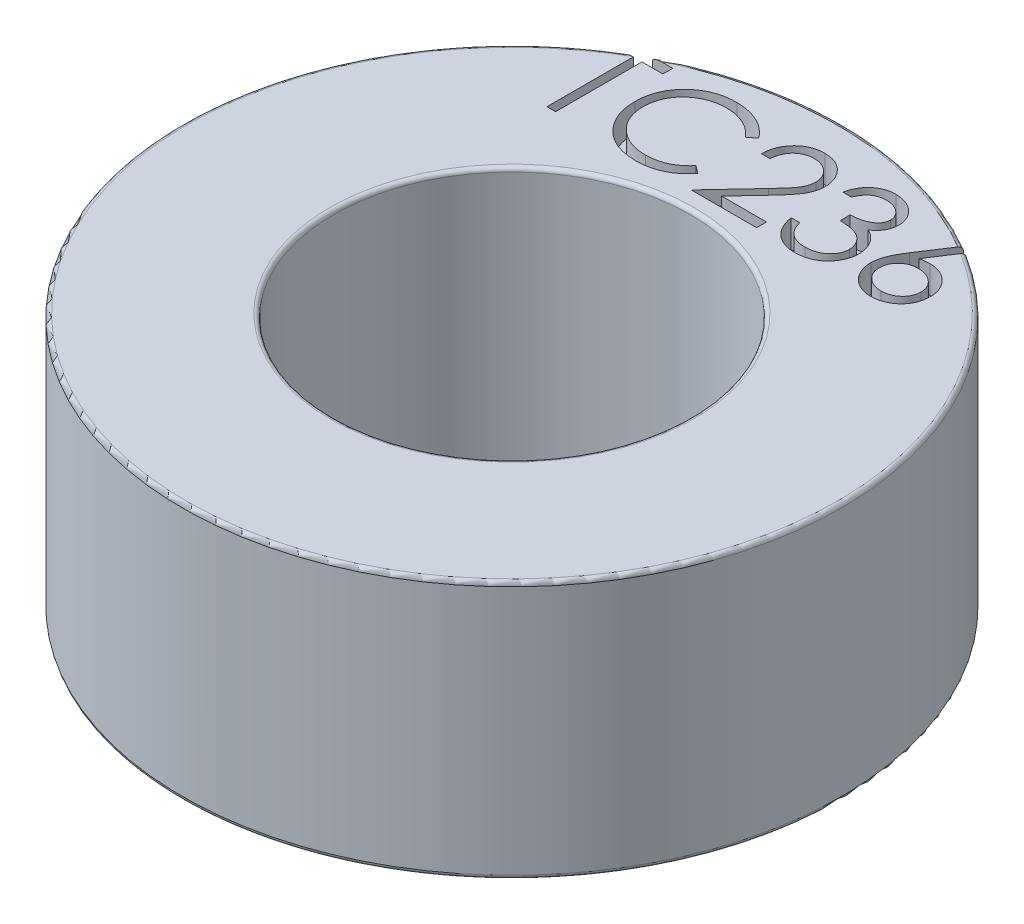
from build123d import *

# Parameters (mm, degrees)
CUT_EXTRUDE1_DEPTH = 1


with BuildPart() as part:
    # Toroidal Core TC236 → Revolve2 (revolve)
    with BuildSketch(Plane.XY, mode=Mode.PRIVATE) as revolve2_sk:
        with BuildLine():
            Line((6.646058459, 0), (11.853941541, 0))
            ThreePointArc((11.853941541, 0), (11.957220468, 0.042779532), (12, 0.146058459))
            Line((12, 0.146058459), (12, 9.243941541))
            ThreePointArc((12, 9.243941541), (11.957220468, 9.347220468), (11.853941541, 9.39))
            Line((11.853941541, 9.39), (6.646058459, 9.39))
            ThreePointArc((6.646058459, 9.39), (6.542779532, 9.347220468), (6.5, 9.243941541))
            Line((6.5, 9.243941541), (6.5, 0.146058459))
            ThreePointArc((6.5, 0.146058459), (6.542779532, 0.042779532), (6.646058459, 0))
        make_face()
    revolve(revolve2_sk.sketch.rotate(Axis((0, -8.107972275, 0), (0, 1, 0)), 90), axis=Axis((0, -8.107972275, 0), (0, 1, 0)))

    # Sketch1 → Cut-Extrude1 (cut)
    # profile 1 of 5: a face of its own
    with BuildSketch(Plane(origin=(0, 9.39, 0), x_dir=(1, 0, 0), z_dir=(0, 1, 0))):
        Polygon((-6.631969117, 10.288046022), (-6.631969117, 10.647020381), (-4.792225527, 10.647020381), (-4.792225527, 10.288046022), (-5.55504604, 10.288046022), (-5.55504604, 7.147020381), (-5.869148604, 7.147020381), (-5.869148604, 10.288046022), align=None)
    # profile 2 of 5: a face of its own
    with BuildSketch(Plane(origin=(0, 9.39, 0), x_dir=(1, 0, 0), z_dir=(0, 1, 0))):
        with BuildLine():
            Line((-1.022994758, 10.004792817), (-1.297834502, 9.794456278))
            add(Edge.make_bspline(
                [(-1.297834502, 9.794456278), (-1.31744039, 9.817822248), (-1.356387837, 9.864239164), (-1.419047039, 9.929418708), (-1.484348682, 9.99048397), (-1.552267803, 10.04772585), (-1.624026923, 10.099142615), (-1.697887721, 10.147413718), (-1.775085767, 10.190681456), (-1.881837501, 10.243144442), (-2.02148535, 10.297890597), (-2.197280189, 10.343793829), (-2.380791287, 10.373015004), (-2.505988887, 10.376179846), (-2.569669437, 10.377789612)],
                knots=[0, 0, 0, 0, 0.757959112, 1.505699292, 2.245454638, 2.979532153, 3.711538275, 4.438200793, 5.171680507, 5.909471876, 7.393775596, 8.890124382, 10.418191784, 12, 12, 12, 12], degree=3))
            add(Edge.make_bspline(
                [(-2.569669437, 10.377789612), (-2.604752737, 10.377385649), (-2.674593729, 10.376581473), (-2.778242203, 10.365972348), (-2.879955254, 10.351061138), (-2.97966672, 10.328935815), (-3.077249679, 10.300963196), (-3.173342081, 10.267537782), (-3.266552681, 10.226182942), (-3.358170919, 10.180474682), (-3.44595013, 10.128847237), (-3.529005178, 10.072533885), (-3.607033145, 10.012164789), (-3.680095758, 9.947513683), (-3.748267706, 9.878871722), (-3.811055017, 9.805507381), (-3.868240427, 9.727655207), (-3.920957452, 9.6463418), (-3.968170185, 9.561804008), (-4.007700065, 9.473728937), (-4.042705187, 9.383624834), (-4.07040443, 9.290473674), (-4.092328947, 9.194930908), (-4.10745661, 9.09674012), (-4.117945081, 8.99610644), (-4.118745258, 8.927897128), (-4.119148604, 8.893514772)],
                knots=[0, 0, 0, 0, 1.054917814, 2.100044995, 3.131103042, 4.146048494, 5.169673617, 6.183595914, 7.203665975, 8.234915748, 9.262203917, 10.264457458, 11.251630812, 12.227803204, 13.197192746, 14.159520551, 15.12972552, 16.100847026, 17.073214652, 18.039054194, 19.002613845, 19.979014051, 20.95965708, 21.949030935, 22.966165397, 24, 24, 24, 24], degree=3))
            add(Edge.make_bspline(
                [(-4.119148604, 8.893514772), (-4.117886785, 8.841783452), (-4.115409371, 8.740215867), (-4.093361037, 8.591445257), (-4.059855945, 8.448924583), (-4.009640368, 8.313544741), (-3.947721318, 8.183636383), (-3.869480706, 8.061397529), (-3.778864169, 7.944980965), (-3.67458975, 7.837138017), (-3.560183934, 7.738624292), (-3.437436022, 7.65187371), (-3.306651734, 7.579558828), (-3.169275104, 7.519382881), (-3.02424899, 7.473126153), (-2.871834188, 7.44056203), (-2.712362192, 7.419319849), (-2.603392793, 7.417286161), (-2.547934662, 7.41625115)],
                knots=[0, 0, 0, 0, 1.029171465, 2.020641659, 2.987623507, 3.938342917, 4.889210282, 5.84687017, 6.821220943, 7.821438502, 8.827599549, 9.822697543, 10.807740252, 11.797342354, 12.80366471, 13.83203677, 14.896651826, 16, 16, 16, 16], degree=3))
            add(Edge.make_bspline(
                [(-2.547934662, 7.41625115), (-2.486831973, 7.41793993), (-2.366567264, 7.421263853), (-2.190199238, 7.449423102), (-2.021363472, 7.495081019), (-1.860050885, 7.558978942), (-1.706716239, 7.64204423), (-1.561119579, 7.742742107), (-1.423138008, 7.86203044), (-1.340166726, 7.953113568), (-1.297834502, 7.999584484)],
                knots=[0, 0, 0, 0, 1.028121516, 2.023589091, 2.998037872, 3.967518031, 4.937445131, 5.927275754, 6.942489185, 8, 8, 8, 8], degree=3))
            Line((-1.297834502, 7.999584484), (-1.022994758, 7.791351311))
            add(Edge.make_bspline(
                [(-1.022994758, 7.791351311), (-1.045112868, 7.762812859), (-1.089243143, 7.705872652), (-1.16070116, 7.625600943), (-1.235978457, 7.550096907), (-1.315634167, 7.479969286), (-1.398751959, 7.41381482), (-1.486824271, 7.353512989), (-1.578693304, 7.298222105), (-1.674047783, 7.24759518), (-1.772786396, 7.202677933), (-1.874790831, 7.164224165), (-1.979621406, 7.131099276), (-2.087282914, 7.103847339), (-2.197998671, 7.082576255), (-2.311369145, 7.06835658), (-2.427639021, 7.058614666), (-2.506080442, 7.05772675), (-2.545831296, 7.057276791)],
                knots=[0, 0, 0, 0, 0.986787822, 1.968848986, 2.935600012, 3.899624008, 4.868462664, 5.837806735, 6.815139263, 7.798259679, 8.787526145, 9.778297419, 10.776456485, 11.791383307, 12.812564526, 13.85620153, 14.913611965, 16, 16, 16, 16], degree=3))
            add(Edge.make_bspline(
                [(-2.545831296, 7.057276791), (-2.583474963, 7.057538784), (-2.657910654, 7.058056842), (-2.767809405, 7.066449009), (-2.874798986, 7.077898746), (-2.978573612, 7.095138877), (-3.079699587, 7.115483217), (-3.177260171, 7.142754474), (-3.272215382, 7.17330364), (-3.364183722, 7.209208627), (-3.453243422, 7.24972481), (-3.539107234, 7.295516369), (-3.621735666, 7.346198233), (-3.701941087, 7.400653244), (-3.778538671, 7.460630545), (-3.852192196, 7.52529718), (-3.923314672, 7.594435191), (-3.967317357, 7.644290044), (-3.989441072, 7.669356118)],
                knots=[0, 0, 0, 0, 1.114604814, 2.203992996, 3.262667896, 4.300477797, 5.318619304, 6.316056647, 7.298880507, 8.271930387, 9.238335007, 10.195173496, 11.151986948, 12.108099108, 13.064862484, 14.031167946, 15.010108607, 16, 16, 16, 16], degree=3))
            add(Edge.make_bspline(
                [(-3.989441072, 7.669356118), (-4.024876716, 7.712897307), (-4.095320192, 7.799454018), (-4.185445876, 7.939739999), (-4.262593431, 8.086208208), (-4.324969352, 8.239628136), (-4.373732085, 8.399655524), (-4.40751328, 8.566371038), (-4.429464885, 8.73961898), (-4.431975173, 8.857455769), (-4.433251168, 8.917352913)],
                knots=[0, 0, 0, 0, 0.994628077, 1.977248131, 2.950237994, 3.925870899, 4.908910175, 5.911660606, 6.938484602, 8, 8, 8, 8], degree=3))
            add(Edge.make_bspline(
                [(-4.433251168, 8.917352913), (-4.431695975, 8.980308367), (-4.428636228, 9.104169291), (-4.402640433, 9.285943244), (-4.360821637, 9.460094643), (-4.301424748, 9.626298388), (-4.226119397, 9.785428668), (-4.133092783, 9.936269873), (-4.023425641, 10.079786673), (-3.897978073, 10.213801424), (-3.760410738, 10.336340777), (-3.613091924, 10.44414698), (-3.456309977, 10.533864496), (-3.291792125, 10.608860659), (-3.118306444, 10.666505122), (-2.936223075, 10.706858309), (-2.74588416, 10.731975425), (-2.616021734, 10.735150633), (-2.550038027, 10.736763971)],
                knots=[0, 0, 0, 0, 1.032925535, 2.032216505, 3.007276963, 3.968222605, 4.92396291, 5.891752235, 6.871517503, 7.883894988, 8.900124299, 9.891468569, 10.874487609, 11.85992873, 12.854644235, 13.869047385, 14.917252991, 16, 16, 16, 16], degree=3))
            add(Edge.make_bspline(
                [(-2.550038027, 10.736763971), (-2.509823555, 10.736281833), (-2.430223058, 10.735327489), (-2.312470406, 10.726021346), (-2.197828079, 10.71050774), (-2.086217097, 10.68939167), (-1.97709448, 10.663184349), (-1.871294239, 10.629044051), (-1.768195553, 10.590007519), (-1.668448644, 10.545049053), (-1.572532094, 10.494582312), (-1.480475776, 10.439166688), (-1.393010917, 10.378870883), (-1.309522069, 10.314207708), (-1.231405858, 10.243809148), (-1.156444379, 10.169611552), (-1.087183301, 10.089477728), (-1.044430106, 10.033072794), (-1.022994758, 10.004792817)],
                knots=[0, 0, 0, 0, 1.096760587, 2.17092713, 3.219439832, 4.250915756, 5.268269357, 6.278326846, 7.281116186, 8.274029601, 9.260640565, 10.235837813, 11.203064059, 12.156899882, 13.114053108, 14.069676657, 15.032185724, 16, 16, 16, 16], degree=3))
        make_face()
    # profile 3 of 5: a face of its own
    with BuildSketch(Plane(origin=(0, 9.39, 0), x_dir=(1, 0, 0), z_dir=(0, 1, 0))):
        with BuildLine():
            Line((-0.170430655, 9.570097304), (-0.484533219, 9.570097304))
            add(Edge.make_bspline(
                [(-0.484533219, 9.570097304), (-0.482486066, 9.611768192), (-0.478465512, 9.693608706), (-0.459637223, 9.812932613), (-0.432696346, 9.926987412), (-0.394604892, 10.034857326), (-0.347298614, 10.137496133), (-0.290568587, 10.234496148), (-0.223374736, 10.325487337), (-0.147168002, 10.40962618), (-0.064399363, 10.486813751), (0.024906576, 10.553468994), (0.118751604, 10.609786665), (0.216851003, 10.656867907), (0.320311566, 10.692207753), (0.428194424, 10.718429393), (0.54097356, 10.734205739), (0.617813582, 10.735901524), (0.656893063, 10.736763971)],
                knots=[0, 0, 0, 0, 1.10065271, 2.161652631, 3.183658789, 4.190468796, 5.17591951, 6.163126047, 7.15150782, 8.156236427, 9.156009102, 10.134482811, 11.092018607, 12.041330605, 13.001268258, 13.972401359, 14.968799086, 16, 16, 16, 16], degree=3))
            add(Edge.make_bspline(
                [(0.656893063, 10.736763971), (0.695271137, 10.735865514), (0.770682681, 10.734100079), (0.880744696, 10.71893905), (0.98552199, 10.695193459), (1.084809757, 10.661878042), (1.177815821, 10.617093615), (1.265238866, 10.563296076), (1.348119677, 10.501076245), (1.42272646, 10.427822431), (1.49123454, 10.349620047), (1.550336795, 10.266132143), (1.600949958, 10.179902858), (1.643137638, 10.090274656), (1.674193777, 9.996403628), (1.697771985, 9.899656425), (1.711099399, 9.799031614), (1.713144822, 9.730925058), (1.714184729, 9.696299227)],
                knots=[0, 0, 0, 0, 1.111607364, 2.184268762, 3.212621178, 4.221274766, 5.211760367, 6.196651075, 7.1921475, 8.207485113, 9.220403448, 10.201281604, 11.166441695, 12.114753415, 13.065576456, 14.026450734, 14.996634279, 16, 16, 16, 16], degree=3))
            add(Edge.make_bspline(
                [(1.714184729, 9.696299227), (1.712491466, 9.647551393), (1.709134655, 9.550911179), (1.680420278, 9.408896316), (1.635573767, 9.271302897), (1.581576411, 9.160565595), (1.527103966, 9.071332101), (1.478016459, 8.997863396), (1.420551648, 8.918757928), (1.35387315, 8.834280591), (1.279360278, 8.743769685), (1.196338114, 8.64727989), (1.104214632, 8.54580812), (1.039556132, 8.476502519), (1.006051716, 8.440590093)],
                knots=[0, 0, 0, 0, 1.184426356, 2.348067706, 3.509069118, 4.696110526, 5.333549288, 6.050745305, 6.844228056, 7.710549037, 8.667450064, 9.695053472, 10.805634456, 12, 12, 12, 12], degree=3))
            Line((1.006051716, 8.440590093), (0.130350595, 7.50599474))
            Line((0.130350595, 7.50599474), (1.759056524, 7.50599474))
            Line((1.759056524, 7.50599474), (1.759056524, 7.147020381))
            Line((1.759056524, 7.147020381), (-0.619148604, 7.147020381))
            Line((-0.619148604, 7.147020381), (0.738223191, 8.595538009))
            add(Edge.make_bspline(
                [(0.738223191, 8.595538009), (0.771271078, 8.630036316), (0.834749305, 8.696300502), (0.924531882, 8.793043463), (1.00517087, 8.882793003), (1.077188263, 8.965379552), (1.139021768, 9.04201112), (1.193894, 9.110205823), (1.237859591, 9.172960273), (1.285574987, 9.245700887), (1.331788968, 9.334513204), (1.371501324, 9.443046894), (1.395716172, 9.554774146), (1.398621008, 9.630276183), (1.400082165, 9.668254355)],
                knots=[0, 0, 0, 0, 1.329631726, 2.553950428, 3.673215718, 4.687767853, 5.603093632, 6.413772471, 7.123043292, 7.734684054, 8.834405432, 9.900288307, 10.943827018, 12, 12, 12, 12], degree=3))
            add(Edge.make_bspline(
                [(1.400082165, 9.668254355), (1.399446423, 9.692135754), (1.398193497, 9.739201404), (1.387135799, 9.808207163), (1.370425293, 9.874771977), (1.346480035, 9.939100596), (1.314873295, 10.000546248), (1.276399915, 10.059183728), (1.232009852, 10.115872694), (1.180658582, 10.169025992), (1.124247063, 10.217707197), (1.064652813, 10.260831283), (1.001602709, 10.296870393), (0.935362587, 10.326413891), (0.866117117, 10.349589272), (0.793732372, 10.365647851), (0.718408356, 10.375730335), (0.66697486, 10.377094507), (0.640767261, 10.377789612)],
                knots=[0, 0, 0, 0, 0.991446411, 1.95395049, 2.89581595, 3.838931463, 4.798493298, 5.75982156, 6.748411868, 7.785213223, 8.824556874, 9.840280684, 10.836137867, 11.835679398, 12.848801643, 13.863922112, 14.911575587, 16, 16, 16, 16], degree=3))
            add(Edge.make_bspline(
                [(0.640767261, 10.377789612), (0.613396429, 10.37707458), (0.559644632, 10.375670374), (0.480725599, 10.36584771), (0.405439822, 10.34890187), (0.333597919, 10.325725195), (0.265078333, 10.296266647), (0.200214289, 10.259574902), (0.1391514, 10.215791409), (0.081774876, 10.166150852), (0.028910897, 10.110883251), (-0.017535978, 10.049273288), (-0.058119993, 9.982445873), (-0.093529226, 9.910581322), (-0.122284916, 9.833027542), (-0.144258067, 9.750059837), (-0.161644913, 9.662038456), (-0.167453434, 9.601253371), (-0.170430655, 9.570097304)],
                knots=[0, 0, 0, 0, 1.031018746, 2.02475058, 2.990194455, 3.934040569, 4.864654155, 5.795059489, 6.735614925, 7.690564532, 8.649604399, 9.611025574, 10.590972636, 11.591080095, 12.624614302, 13.701020113, 14.821632451, 16, 16, 16, 16], degree=3))
        make_face()
    # profile 4 of 5: a face of its own
    with BuildSketch(Plane(origin=(0, 9.39, 0), x_dir=(1, 0, 0), z_dir=(0, 1, 0))):
        with BuildLine():
            Line((2.521877037, 9.839328073), (2.207774473, 9.839328073))
            add(Edge.make_bspline(
                [(2.207774473, 9.839328073), (2.216284024, 9.874560557), (2.232919499, 9.943437182), (2.267617073, 10.041844443), (2.305416328, 10.134967964), (2.350805432, 10.221064038), (2.400314187, 10.30186294), (2.457036908, 10.375532065), (2.518356631, 10.44394503), (2.58618158, 10.504658268), (2.657310242, 10.559635997), (2.732744861, 10.606511054), (2.810967755, 10.646835207), (2.892520888, 10.680055439), (2.97764706, 10.705080963), (3.065576683, 10.723237768), (3.156540183, 10.735028883), (3.218287774, 10.736179646), (3.24964146, 10.736763971)],
                knots=[0, 0, 0, 0, 1.162005537, 2.271625781, 3.343758855, 4.383309926, 5.390229558, 6.379919256, 7.361854164, 8.333198761, 9.295911338, 10.242430842, 11.177959212, 12.116337295, 13.062827104, 14.020064771, 14.994644689, 16, 16, 16, 16], degree=3))
            add(Edge.make_bspline(
                [(3.24964146, 10.736763971), (3.295324202, 10.735384741), (3.385693213, 10.732656365), (3.51845626, 10.707741929), (3.646483079, 10.668316796), (3.768372327, 10.613843069), (3.88159076, 10.546655756), (3.982326946, 10.466691019), (4.069215457, 10.375491718), (4.142109835, 10.274759153), (4.199184834, 10.167103644), (4.241271207, 10.056303487), (4.266892888, 9.942621515), (4.270213445, 9.865864236), (4.271877037, 9.827409003)],
                knots=[0, 0, 0, 0, 1.083050992, 2.142477498, 3.193116406, 4.255571735, 5.30263384, 6.308962982, 7.297363603, 8.282367274, 9.249857812, 10.179914175, 11.08814088, 12, 12, 12, 12], degree=3))
            add(Edge.make_bspline(
                [(4.271877037, 9.827409003), (4.270713446, 9.790402208), (4.268436479, 9.717985654), (4.249102773, 9.612264157), (4.21656651, 9.512622556), (4.171496748, 9.418641394), (4.113155198, 9.330916554), (4.042482501, 9.249250663), (3.958979839, 9.173281505), (3.895700901, 9.129762032), (3.863123031, 9.107356919)],
                knots=[0, 0, 0, 0, 1.024540389, 2.004866551, 2.965041327, 3.920577974, 4.882998113, 5.874504559, 6.905732034, 8, 8, 8, 8], degree=3))
            add(Edge.make_bspline(
                [(3.863123031, 9.107356919), (3.900354785, 9.089378748), (3.974121659, 9.05375879), (4.074672189, 8.983903033), (4.165950064, 8.903246685), (4.216853783, 8.840304033), (4.242429922, 8.808679035)],
                knots=[0, 0, 0, 0, 1.015518401, 2.012035669, 3.001164323, 4, 4, 4, 4], degree=3))
            add(Edge.make_bspline(
                [(4.242429922, 8.808679035), (4.259271264, 8.785621283), (4.29267816, 8.739883367), (4.333913694, 8.666346941), (4.371322808, 8.591995452), (4.400473027, 8.514836045), (4.423046894, 8.435763032), (4.439182926, 8.354640636), (4.449207067, 8.271402613), (4.450642619, 8.215090133), (4.451364216, 8.186784003)],
                knots=[0, 0, 0, 0, 1.025084078, 2.033381695, 3.024893161, 4.013698104, 4.991890475, 5.976764909, 6.982997093, 8, 8, 8, 8], degree=3))
            add(Edge.make_bspline(
                [(4.451364216, 8.186784003), (4.449569703, 8.137774282), (4.445989121, 8.03998548), (4.413985047, 7.895510758), (4.364371806, 7.754285256), (4.29391487, 7.619210417), (4.208047361, 7.492830036), (4.105890037, 7.379753727), (3.988603628, 7.282555122), (3.85779798, 7.201344894), (3.716080851, 7.136426972), (3.564505259, 7.091369529), (3.405255205, 7.062023529), (3.296047908, 7.058876661), (3.240526877, 7.057276791)],
                knots=[0, 0, 0, 0, 0.955779014, 1.907060117, 2.875433937, 3.871313158, 4.872415639, 5.851225146, 6.836215519, 7.83643374, 8.849228613, 9.86973379, 10.916971861, 12, 12, 12, 12], degree=3))
            add(Edge.make_bspline(
                [(3.240526877, 7.057276791), (3.203107576, 7.058145005), (3.129478871, 7.059853359), (3.021235373, 7.07153196), (2.917913674, 7.092861965), (2.819374076, 7.121565271), (2.725529039, 7.157957013), (2.636664934, 7.203275711), (2.552235041, 7.256587213), (2.473036089, 7.3185208), (2.399077522, 7.38780214), (2.332324798, 7.46566115), (2.271665005, 7.550658554), (2.218722366, 7.64378161), (2.171085413, 7.743826868), (2.131904457, 7.852075366), (2.097418888, 7.967559388), (2.081385424, 8.048037128), (2.073159088, 8.089328073)],
                knots=[0, 0, 0, 0, 1.048658725, 2.063410685, 3.046034179, 4.001477787, 4.936774919, 5.862367409, 6.792675028, 7.730719943, 8.675894397, 9.627829632, 10.600096036, 11.597688215, 12.626045268, 13.701542398, 14.82072376, 16, 16, 16, 16], degree=3))
            Line((2.073159088, 8.089328073), (2.387261652, 8.089328073))
            add(Edge.make_bspline(
                [(2.387261652, 8.089328073), (2.395444944, 8.06237906), (2.411362156, 8.009960888), (2.438456454, 7.934520583), (2.469324727, 7.86536253), (2.502439285, 7.801979408), (2.537217731, 7.743747005), (2.576132656, 7.692205136), (2.616301801, 7.645089934), (2.646581155, 7.618545322), (2.661400274, 7.605554035)],
                knots=[0, 0, 0, 0, 1.198163088, 2.33053128, 3.407730985, 4.417276592, 5.372219308, 6.28897303, 7.162600585, 8, 8, 8, 8], degree=3))
            add(Edge.make_bspline(
                [(2.661400274, 7.605554035), (2.680996851, 7.590445701), (2.720129514, 7.560275669), (2.783897745, 7.521774041), (2.850962631, 7.488413015), (2.922777305, 7.46292932), (2.997792075, 7.441351659), (3.077219441, 7.42723114), (3.160358658, 7.417542968), (3.217126421, 7.416688037), (3.246135851, 7.41625115)],
                knots=[0, 0, 0, 0, 0.946170439, 1.889420265, 2.845303464, 3.807233317, 4.801018734, 5.828864929, 6.890507805, 8, 8, 8, 8], degree=3))
            add(Edge.make_bspline(
                [(3.246135851, 7.41625115), (3.278889354, 7.416867055), (3.342936001, 7.418071405), (3.43639086, 7.429147112), (3.525298308, 7.445277525), (3.608671233, 7.470190508), (3.687601741, 7.50097136), (3.76098339, 7.539619765), (3.829779496, 7.584964487), (3.893108902, 7.636503645), (3.950054409, 7.69292514), (4.000193923, 7.751938212), (4.042818584, 7.813294041), (4.077202162, 7.877332162), (4.104352713, 7.943787391), (4.122835913, 8.01284622), (4.135687428, 8.083943486), (4.13673404, 8.132272455), (4.137261652, 8.156635766)],
                knots=[0, 0, 0, 0, 1.217147791, 2.380027433, 3.494444702, 4.572153297, 5.609568379, 6.639424714, 7.649109417, 8.668170816, 9.669597737, 10.625200337, 11.543417969, 12.441394052, 13.322311151, 14.205496177, 15.095365482, 16, 16, 16, 16], degree=3))
            add(Edge.make_bspline(
                [(4.137261652, 8.156635766), (4.135731351, 8.189247105), (4.132678362, 8.254307513), (4.109369783, 8.350025087), (4.071030919, 8.442248499), (4.017358407, 8.52940429), (3.952022679, 8.610180191), (3.875657772, 8.682251674), (3.787629543, 8.741721765), (3.706609674, 8.782810421), (3.634844518, 8.810847496), (3.573429133, 8.829522461), (3.50467253, 8.845336116), (3.429406181, 8.860048388), (3.347062965, 8.872569736), (3.257732527, 8.883011552), (3.161396765, 8.891366593), (3.094705599, 8.895097688), (3.060338575, 8.897020381)],
                knots=[0, 0, 0, 0, 1.07054697, 2.135767047, 3.216561865, 4.33974944, 5.486079747, 6.621378074, 7.775625952, 8.963672916, 9.598146892, 10.304877434, 11.070270905, 11.915000392, 12.823868403, 13.805723172, 14.86925407, 16, 16, 16, 16], degree=3))
            Line((3.060338575, 8.897020381), (3.060338575, 9.25599474))
            add(Edge.make_bspline(
                [(3.060338575, 9.25599474), (3.103639741, 9.256729544), (3.188456088, 9.258168844), (3.312350392, 9.275576854), (3.430823705, 9.299657482), (3.541250447, 9.336542674), (3.64189916, 9.379382971), (3.729218762, 9.429235181), (3.801985909, 9.48464993), (3.859846981, 9.546482539), (3.903376209, 9.612797587), (3.935203007, 9.681914245), (3.954003333, 9.754438305), (3.956513, 9.803932973), (3.957774473, 9.828811246)],
                knots=[0, 0, 0, 0, 1.321986639, 2.589447074, 3.816329219, 5.01088745, 6.139805852, 7.153945165, 8.075214402, 8.924034688, 9.728124013, 10.488707548, 11.240355623, 12, 12, 12, 12], degree=3))
            add(Edge.make_bspline(
                [(3.957774473, 9.828811246), (3.957360062, 9.847088992), (3.956535611, 9.883451699), (3.946138333, 9.936576767), (3.930514292, 9.988077713), (3.909034563, 10.037735524), (3.880284364, 10.085205797), (3.845878378, 10.130893246), (3.804910277, 10.174537025), (3.75796483, 10.215217345), (3.707553025, 10.253986582), (3.65230325, 10.286900219), (3.593881376, 10.315045281), (3.532222721, 10.338254783), (3.46712719, 10.355714071), (3.398900633, 10.368249913), (3.327412949, 10.376087568), (3.278641217, 10.377215983), (3.253848191, 10.377789612)],
                knots=[0, 0, 0, 0, 0.884392785, 1.759457502, 2.611959086, 3.489218968, 4.37281399, 5.2945488, 6.255912374, 7.266815255, 8.301784654, 9.332968512, 10.37626691, 11.440494194, 12.520033166, 13.637162961, 14.798855837, 16, 16, 16, 16], degree=3))
            add(Edge.make_bspline(
                [(3.253848191, 10.377789612), (3.213996523, 10.37639825), (3.136156946, 10.373680596), (3.023942029, 10.349877583), (2.919622695, 10.311899499), (2.839884029, 10.26656648), (2.781001455, 10.221816046), (2.738924517, 10.18273366), (2.697604006, 10.139300836), (2.659758329, 10.088842461), (2.621484353, 10.03477567), (2.586639791, 9.974351989), (2.552780099, 9.909147595), (2.532377549, 9.86305196), (2.521877037, 9.839328073)],
                knots=[0, 0, 0, 0, 1.472543308, 2.876219568, 4.221790263, 5.565193594, 6.249813518, 6.953379497, 7.687249741, 8.463570142, 9.283606569, 10.136032583, 11.040678096, 12, 12, 12, 12], degree=3))
        make_face()
    # profile 5 of 5: a face of its own
    with BuildSketch(Plane(origin=(0, 9.39, 0), x_dir=(1, 0, 0), z_dir=(0, 1, 0))):
        with BuildLine():
            Line((6.380851396, 10.736763971), (6.622738415, 10.546759964))
            Line((6.622738415, 10.546759964), (5.697958768, 9.132597304))
            add(Edge.make_bspline(
                [(5.697958768, 9.132597304), (5.759529045, 9.142411165), (5.879628831, 9.16155421), (6.00119473, 9.164712155), (6.060438736, 9.16625115)],
                knots=[0, 0, 0, 0, 1.025318673, 2, 2, 2, 2], degree=3))
            add(Edge.make_bspline(
                [(6.060438736, 9.16625115), (6.096011232, 9.165295039), (6.166034632, 9.163412961), (6.268841435, 9.14892911), (6.367630371, 9.126103999), (6.461991983, 9.092831743), (6.552264965, 9.050329388), (6.638967361, 8.999390518), (6.720469371, 8.937384838), (6.79782055, 8.868119882), (6.868047648, 8.791402897), (6.930223703, 8.710001561), (6.982450495, 8.62400068), (7.024824416, 8.533443814), (7.057729295, 8.438470554), (7.08171694, 8.339202415), (7.095896533, 8.235570943), (7.097822024, 8.165092768), (7.098800114, 8.129292016)],
                knots=[0, 0, 0, 0, 1.04369286, 2.054478336, 3.041073146, 4.015093852, 4.984733326, 5.965804835, 6.960378782, 7.985147595, 9.009457201, 10.008161701, 10.986880575, 11.956520048, 12.937015923, 13.931873656, 14.949455224, 16, 16, 16, 16], degree=3))
            add(Edge.make_bspline(
                [(7.098800114, 8.129292016), (7.097377009, 8.080312312), (7.094576675, 7.983931846), (7.066672879, 7.843555139), (7.023313235, 7.709822624), (6.961335706, 7.584869452), (6.884353323, 7.468866883), (6.790475731, 7.366081417), (6.683032242, 7.27441138), (6.561545444, 7.197754761), (6.43080248, 7.13515171), (6.293450482, 7.090186468), (6.150823336, 7.062502998), (6.054018728, 7.059032396), (6.005050114, 7.057276791)],
                knots=[0, 0, 0, 0, 1.031375318, 2.029502543, 3.004789286, 3.987476834, 4.960371455, 5.9300674, 6.912260825, 7.929083631, 8.949397511, 9.960523116, 10.96833055, 12, 12, 12, 12], degree=3))
            add(Edge.make_bspline(
                [(6.005050114, 7.057276791), (5.957953413, 7.058804997), (5.864663095, 7.061832105), (5.727430301, 7.088798043), (5.595567284, 7.132505146), (5.469997903, 7.192719424), (5.35367729, 7.268777307), (5.249611653, 7.360339586), (5.158319879, 7.465449051), (5.082345258, 7.584089399), (5.022086526, 7.711579356), (4.976896601, 7.844516513), (4.950500358, 7.982416494), (4.946811801, 8.075897633), (4.94495396, 8.122981919)],
                knots=[0, 0, 0, 0, 1.012016664, 2.004627821, 2.994792927, 3.992885782, 4.990978636, 5.973936114, 6.964471063, 7.975201453, 8.993600317, 9.990122807, 10.98767138, 12, 12, 12, 12], degree=3))
            add(Edge.make_bspline(
                [(4.94495396, 8.122981919), (4.946135405, 8.159026503), (4.94854769, 8.232622655), (4.96539108, 8.344086683), (4.992455875, 8.458137764), (5.022766121, 8.554891958), (5.054791732, 8.63415348), (5.081444271, 8.698056971), (5.114618267, 8.763818044), (5.149991648, 8.83369168), (5.190748517, 8.905877112), (5.235064167, 8.981580782), (5.284163818, 9.05959871), (5.31858398, 9.112542905), (5.336179922, 9.139608522)],
                knots=[0, 0, 0, 0, 1.173818275, 2.396712641, 3.66331629, 4.989737886, 5.693666774, 6.447286557, 7.243889047, 8.091586357, 8.998013824, 9.943181721, 10.948533338, 12, 12, 12, 12], degree=3))
            Line((5.336179922, 9.139608522), (6.380851396, 10.736763971))
        make_face()
        with BuildLine():
            add(Edge.make_bspline(
                [(5.994533287, 8.807276791), (5.967871042, 8.806498748), (5.915791933, 8.804979002), (5.839384518, 8.79615375), (5.767071267, 8.779534685), (5.697894133, 8.758368353), (5.63314643, 8.729265293), (5.57235759, 8.693913494), (5.515292538, 8.652292316), (5.462548987, 8.604991405), (5.414729323, 8.553203372), (5.373548192, 8.49773385), (5.338025792, 8.439919647), (5.309143973, 8.379277704), (5.286653898, 8.315831205), (5.270385647, 8.249871955), (5.261331896, 8.180957649), (5.259825664, 8.134225147), (5.259056524, 8.110361727)],
                knots=[0, 0, 0, 0, 1.129588631, 2.206414736, 3.251139165, 4.268635594, 5.265702196, 6.250456724, 7.242448911, 8.251968645, 9.246821453, 10.222880186, 11.173611482, 12.116736599, 13.062300278, 14.020270554, 14.989073742, 16, 16, 16, 16], degree=3))
            add(Edge.make_bspline(
                [(5.259056524, 8.110361727), (5.259682886, 8.086711747), (5.260911087, 8.040337658), (5.272063407, 7.971998478), (5.289098489, 7.90623357), (5.314438885, 7.843381971), (5.344665773, 7.782485653), (5.384571098, 7.725750367), (5.428787883, 7.669730297), (5.481641817, 7.618728826), (5.53836518, 7.571272202), (5.598966382, 7.529791948), (5.662126342, 7.494305775), (5.728697764, 7.466494677), (5.797736148, 7.44367039), (5.869816702, 7.427608911), (5.944989558, 7.418528385), (5.995911496, 7.417020191), (6.021877037, 7.41625115)],
                knots=[0, 0, 0, 0, 0.989467248, 1.94019797, 2.891935182, 3.827694429, 4.772920941, 5.730924762, 6.725747692, 7.756678648, 8.79901574, 9.819492441, 10.826891316, 11.826466727, 12.835195252, 13.867842842, 14.912794438, 16, 16, 16, 16], degree=3))
            add(Edge.make_bspline(
                [(6.021877037, 7.41625115), (6.047842535, 7.417020252), (6.09876439, 7.418528564), (6.17393785, 7.427608232), (6.246016169, 7.44367288), (6.315062678, 7.466485651), (6.381604109, 7.49433926), (6.44470883, 7.52957118), (6.504736924, 7.571527298), (6.561497523, 7.618647726), (6.614131462, 7.670020578), (6.65940874, 7.7252503), (6.698091974, 7.782944196), (6.729526161, 7.843142085), (6.754587452, 7.906271573), (6.771708919, 7.971988297), (6.782838208, 8.040340323), (6.784069574, 8.086712648), (6.78469755, 8.110361727)],
                knots=[0, 0, 0, 0, 1.087397944, 2.132534446, 3.165364764, 4.174271784, 5.174024072, 6.181601208, 7.194203697, 8.236725232, 9.267838612, 10.269026844, 11.221737037, 12.171628256, 13.107553087, 14.05945871, 15.010357665, 16, 16, 16, 16], degree=3))
            add(Edge.make_bspline(
                [(6.78469755, 8.110361727), (6.784147257, 8.134256278), (6.783067211, 8.181153511), (6.770851262, 8.249841129), (6.753908888, 8.316166335), (6.728325857, 8.379712284), (6.695089313, 8.440228211), (6.654605906, 8.498019812), (6.607773335, 8.55353016), (6.553675796, 8.605092968), (6.494785562, 8.652240046), (6.432169976, 8.693859602), (6.366662003, 8.728984579), (6.29832806, 8.758291681), (6.226385178, 8.779441155), (6.151994838, 8.796094398), (6.074205596, 8.804956416), (6.021428987, 8.806493481), (5.994533287, 8.807276791)],
                knots=[0, 0, 0, 0, 0.978206639, 1.919901502, 2.851605144, 3.780102724, 4.718870031, 5.675451981, 6.667674623, 7.690630536, 8.733308323, 9.756129687, 10.767539656, 11.776269907, 12.797430371, 13.836405707, 14.897401972, 16, 16, 16, 16], degree=3))
        make_face(mode=Mode.SUBTRACT)
    extrude(amount=-CUT_EXTRUDE1_DEPTH, mode=Mode.SUBTRACT)


solid = part.part
